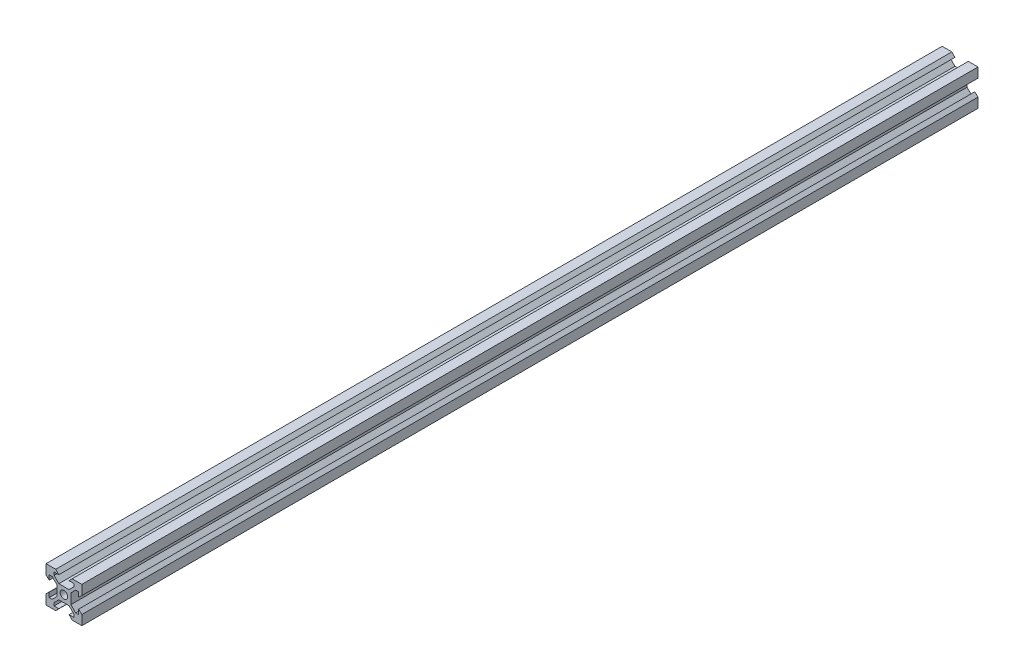
from build123d import *

# Parameters (mm, degrees)
SKETCH1_R           = 2.1
BOSS_EXTRUDE1_DEPTH = 500


with BuildPart() as part:
    # Sketch1 → Boss-Extrude1 (new body)
    with BuildSketch(Plane.XY):
        Polygon((-4.58, 10), (-2.885, 8.2), (-5.5, 8.2), (-5.5, 6.560660172), (-2.839339828, 3.9), (2.839339828, 3.9), (5.5, 6.560660172), (5.5, 8.2), (2.885, 8.2), (4.58, 10), (10, 10), (10, 4.58), (8.2, 2.885), (8.2, 5.5), (6.560660172, 5.5), (3.9, 2.839339828), (3.9, -2.839339828), (6.560660172, -5.5), (8.2, -5.5), (8.2, -2.885), (10, -4.58), (10, -10), (4.58, -10), (2.885, -8.2), (5.5, -8.2), (5.5, -6.560660172), (2.839339828, -3.9), (-2.839339828, -3.9), (-5.5, -6.560660172), (-5.5, -8.2), (-2.885, -8.2), (-4.58, -10), (-10, -10), (-10, -4.58), (-8.2, -2.885), (-8.2, -5.5), (-6.560660172, -5.5), (-3.9, -2.839339828), (-3.9, 2.839339828), (-6.560660172, 5.5), (-8.2, 5.5), (-8.2, 2.885), (-10, 4.58), (-10, 10), align=None)
        Circle(SKETCH1_R, mode=Mode.SUBTRACT)
    extrude(amount=BOSS_EXTRUDE1_DEPTH)


solid = part.part
